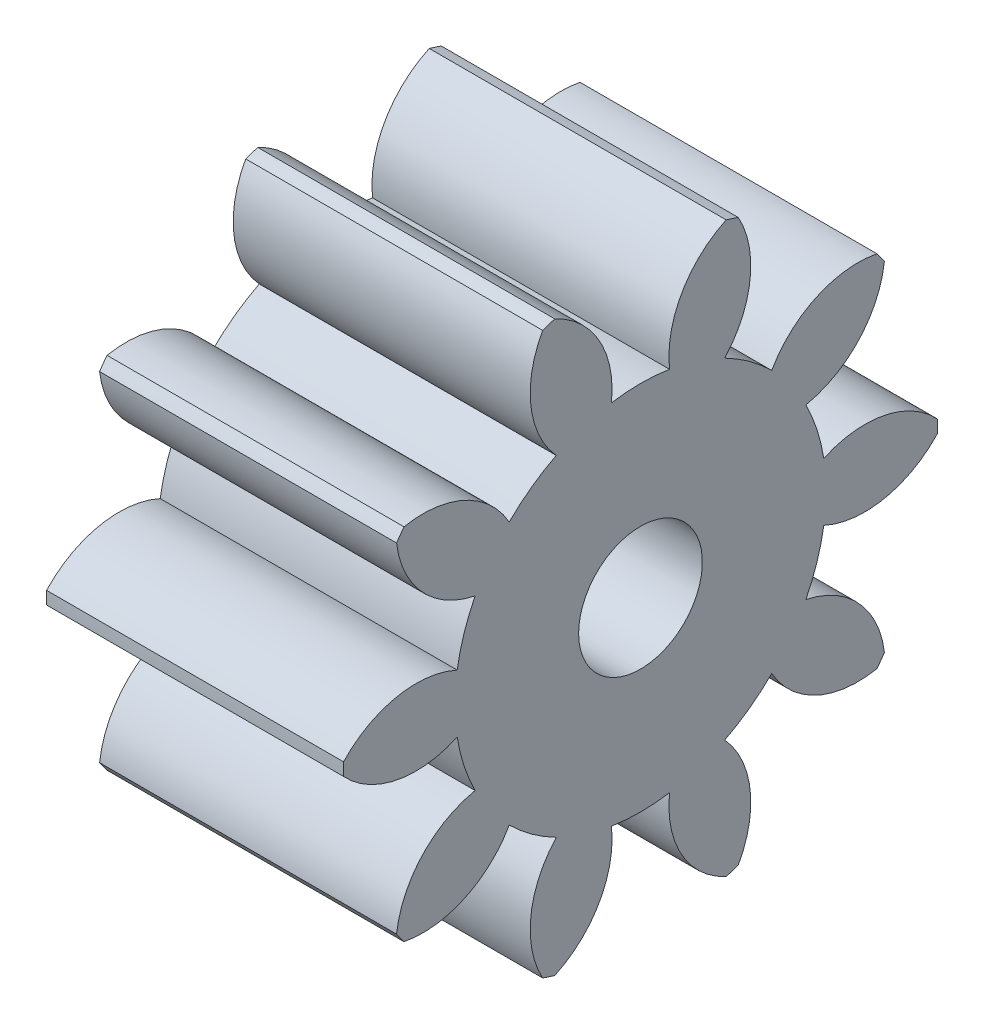
from build123d import *

# Parameters (mm, degrees)
BASPROSKE_W     = 12
BASPROSKE_H     = 12
TOOTHCUT_DEPTH  = 21.784609691
TEETHCUTS_COUNT = 10
TEETHCUTS_ANGLE = 324
BORSKE_R        = 2.5
BORE_DEPTH      = 50.0000508


with BuildPart() as part:
    # BasProSke → Base-Revolve (revolve)
    with BuildSketch(Plane(origin=(0, 0, 0), x_dir=(1, 0, 0), z_dir=(0, 1, 0)), mode=Mode.PRIVATE) as base_revolve_sk:
        with Locations((6, 6)):
            Rectangle(BASPROSKE_W, BASPROSKE_H)
    revolve(base_revolve_sk.sketch.rotate(Axis((-10, 0, 0), (1, 0, 0)), 180), axis=Axis((-10, 0, 0), (1, 0, 0)))

    # TooCutSke → ToothCut (cut, through all)
    with BuildSketch(Plane(origin=(0, 0, 0), x_dir=(0, 0, -1), z_dir=(1, 0, 0))):
        with BuildLine():
            ThreePointArc((1.173662691, 7.406586048), (0, 7.499), (-1.173662691, 7.406586048))
            ThreePointArc((-1.173662691, 7.406586048), (-1.668191438, 9.834565786), (-3.497907776, 11.50542856))
            ThreePointArc((-3.497907776, 11.50542856), (0, 12.0254), (3.497907776, 11.50542856))
            ThreePointArc((3.497907776, 11.50542856), (1.668191438, 9.834565786), (1.173662691, 7.406586048))
        make_face()
    toothcut = extrude(amount=TOOTHCUT_DEPTH, mode=Mode.SUBTRACT)

    # TeethCuts: ToothCut ×10 about axis
    teethcuts_axis = Axis((-10, 0, 0), (1, 0, 0))
    for i in range(1, TEETHCUTS_COUNT):
        add(toothcut.rotate(teethcuts_axis, i * TEETHCUTS_ANGLE / (TEETHCUTS_COUNT - 1)), mode=Mode.SUBTRACT)

    # BorSke → Bore (cut, symmetric)
    with BuildSketch(Plane(origin=(0, 0, 0), x_dir=(0, 0, -1), z_dir=(1, 0, 0))):
        with Locations(Location((0, 0, 0), (0, 0, 180))):
            Circle(BORSKE_R)
    extrude(amount=BORE_DEPTH, both=True, mode=Mode.SUBTRACT)


solid = part.part
